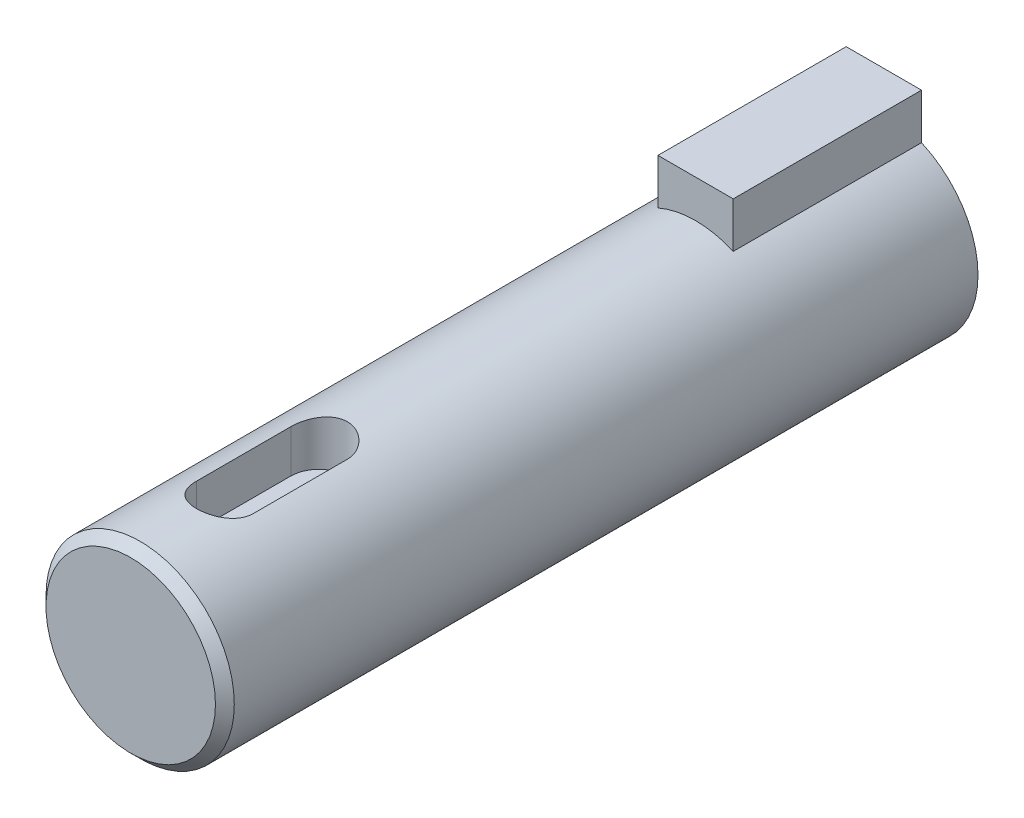
from build123d import *

# Parameters (mm, degrees)
BOSS_EXTRUDE1_DEPTH = 10
SKETCH2_R           = 5
BOSS_EXTRUDE2_DEPTH = 30
CUT_EXTRUDE2_START  = 2.5
CUT_EXTRUDE2_DEPTH  = 39.414545091
CHAMFER2_SIZE       = 0.5


with BuildPart() as part:
    # Sketch1 → Boss-Extrude1 (new body)
    with BuildSketch(Plane.XY):
        with BuildLine():
            Line((-2, 7), (2, 7))
            Line((2, 7), (2, 4.582575695))
            ThreePointArc((2, 4.582575695), (0, -5), (-2, 4.582575695))
            Line((-2, 4.582575695), (-2, 7))
        make_face()
    extrude(amount=BOSS_EXTRUDE1_DEPTH)

    # Sketch2 → Boss-Extrude2 (add)
    with BuildSketch(Plane.XY.offset(10)):
        with Locations(Location((0, 0, 0), (0, 0, 113.578178478))):
            Circle(SKETCH2_R)
    extrude(amount=BOSS_EXTRUDE2_DEPTH)

    # Sketch3 → Cut-Extrude2 (cut, through all)
    with BuildSketch(Plane(origin=(0, 0, 0), x_dir=(1, 0, 0), z_dir=(0, 1, 0)).offset(CUT_EXTRUDE2_START)):
        with BuildLine():
            Line((1.5, -30), (1.5, -35))
            ThreePointArc((1.5, -35), (0, -36.5), (-1.5, -35))
            Line((-1.5, -35), (-1.5, -30))
            ThreePointArc((-1.5, -30), (0, -28.5), (1.5, -30))
        make_face()
    extrude(amount=CUT_EXTRUDE2_DEPTH, mode=Mode.SUBTRACT)

    # Chamfer2
    chamfer2_edges = [part.edges().sort_by_distance(p)[0] for p in [
        (2, -4.582575695, 40),
    ]]
    chamfer(chamfer2_edges, length=CHAMFER2_SIZE)


solid = part.part
